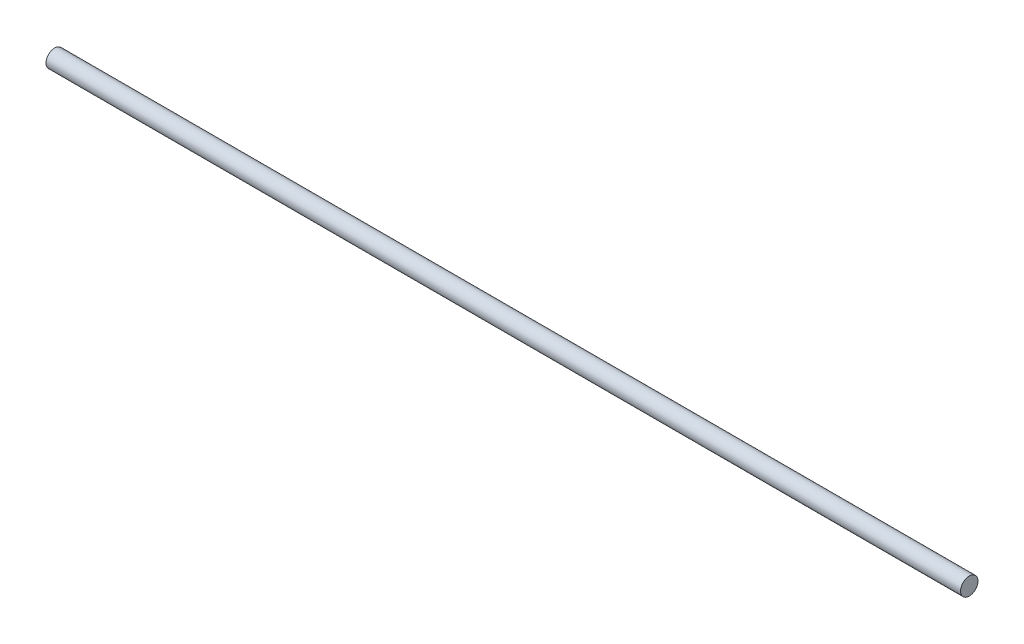
from build123d import *

# Parameters (mm, degrees)
SKETCH1_R           = 4
BOSS_EXTRUDE1_DEPTH = 420


with BuildPart() as part:
    # Sketch1 → Boss-Extrude1 (new body)
    with BuildSketch(Plane(origin=(0, 0, 0), x_dir=(0, 0, -1), z_dir=(1, 0, 0))):
        Circle(SKETCH1_R)
    extrude(amount=BOSS_EXTRUDE1_DEPTH)


solid = part.part
